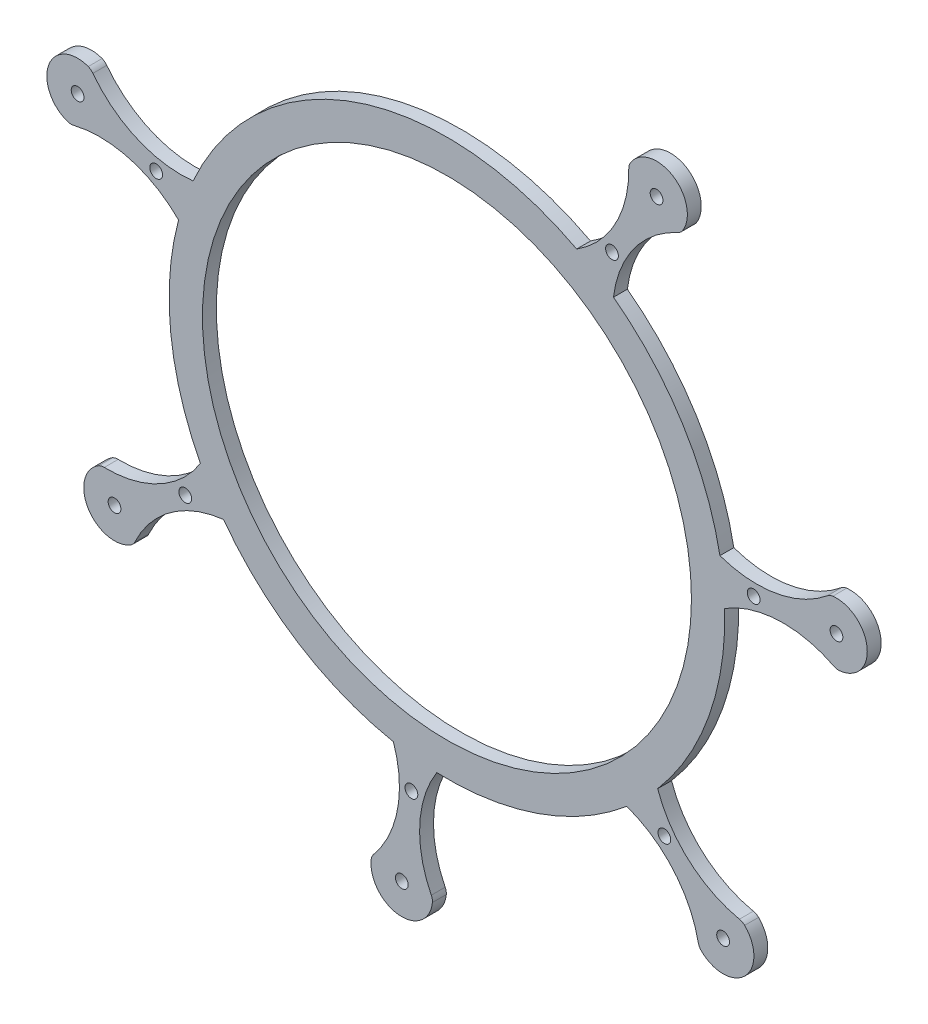
from build123d import *

# Parameters (mm, degrees)
SKETCH1_R           = 1.4605
SKETCH1_R_2         = 55.88
BOSS_EXTRUDE1_DEPTH = 3.175


with BuildPart() as part:
    # Sketch1 → Boss-Extrude1 (new body)
    with BuildSketch(Plane.XY):
        with BuildLine():
            ThreePointArc((88.371221891, 2.992104588), (75.778671602, 5.722307778), (63.466706043, 1.922066166))
            ThreePointArc((63.466706043, 1.922066166), (59.865004486, -21.176198252), (48.149108175, -41.405875631))
            ThreePointArc((48.149108175, -41.405875631), (55.331871693, -52.10275973), (66.839271225, -57.898894408))
            ThreePointArc((66.839271225, -57.898894408), (67.47896866, -58.129774903), (68.034473997, -58.522117141))
            ThreePointArc((68.034473997, -58.522117141), (68.066383731, -68.535675481), (58.053237429, -68.439394687))
            ThreePointArc((58.053237429, -68.439394687), (57.667420479, -67.877380582), (57.444971188, -67.232996469))
            ThreePointArc((57.444971188, -67.232996469), (51.728203311, -55.685490362), (41.080669811, -48.429019967))
            ThreePointArc((41.080669811, -48.429019967), (20.776095309, -60.014628604), (-2.344845215, -63.467769564))
            ThreePointArc((-2.344845215, -63.467769564), (-6.228950943, -75.752050976), (-3.586132247, -88.361783585))
            ThreePointArc((-3.586132247, -88.361783585), (-3.36770111, -89.003157809), (-3.32660045, -89.679459363))
            ThreePointArc((-3.32660045, -89.679459363), (-11.135620218, -95.947758903), (-17.303439466, -88.059135792))
            ThreePointArc((-17.303439466, -88.059135792), (-17.104674606, -87.410023107), (-16.741077367, -86.836741505))
            ThreePointArc((-16.741077367, -86.836741505), (-11.27722002, -75.167440106), (-12.242511565, -62.318527916))
            ThreePointArc((-12.242511565, -62.318527916), (-33.964407462, -53.664473517), (-51.081326085, -37.735113336))
            ThreePointArc((-51.081326085, -37.735113336), (-63.106619809, -42.363141327), (-71.313643792, -52.296473576))
            ThreePointArc((-71.313643792, -52.296473576), (-71.67843667, -52.862852869), (-72.179293677, -53.313409866))
            ThreePointArc((-72.179293677, -53.313409866), (-81.948891787, -51.116293203), (-79.626890286, -41.375621876))
            ThreePointArc((-79.626890286, -41.375621876), (-78.996252753, -41.130558358), (-78.323292008, -41.060675146))
            ThreePointArc((-78.323292008, -41.060675146), (-65.793205462, -38.056800419), (-56.34937083, -29.290939384))
            ThreePointArc((-56.34937083, -29.290939384), (-63.126842761, -6.911975648), (-61.344922052, 16.402760085))
            ThreePointArc((-61.344922052, 16.402760085), (-72.460908038, 22.91898505), (-85.344095674, 23.142163421))
            ThreePointArc((-85.344095674, 23.142163421), (-86.013413894, 23.077972745), (-86.676123345, 23.191654347))
            ThreePointArc((-86.676123345, 23.191654347), (-91.049593156, 32.199713553), (-81.986285397, 36.457508913))
            ThreePointArc((-81.986285397, 36.457508913), (-81.402337069, 36.113799392), (-80.930038908, 35.627932814))
            ThreePointArc((-80.930038908, 35.627932814), (-70.769133899, 27.704401933), (-58.027573187, 25.786339663))
            ThreePointArc((-58.027573187, 25.786339663), (-20.78382715, 59.992758023), (29.638172071, 56.145983995))
            ThreePointArc((29.638172071, 56.145983995), (38.464561255, 65.533272539), (41.548923024, 78.043789903))
            ThreePointArc((41.548923024, 78.043789903), (41.643702385, 78.713927363), (41.912089569, 79.335245044))
            ThreePointArc((41.912089569, 79.335245044), (51.667486511, 81.594581089), (53.801754345, 71.811060778))
            ThreePointArc((53.801754345, 71.811060778), (53.328466449, 71.314142081), (52.739428076, 70.96205769))
            ThreePointArc((52.739428076, 70.96205769), (42.75772259, 62.814605524), (38.058107022, 50.817562776))
            ThreePointArc((38.058107022, 50.817562776), (53.871433145, 33.600106803), (62.38288993, 11.827252681))
            ThreePointArc((62.38288993, 11.827252681), (75.225331292, 10.779382415), (86.929515737, 16.168111273))
            ThreePointArc((86.929515737, 16.168111273), (87.512909807, 16.51581617), (88.167585105, 16.696502613))
            ThreePointArc((88.167585105, 16.696502613), (96.016395661, 10.478099143), (89.698025701, 2.709536219))
            ThreePointArc((89.698025701, 2.709536219), (89.01541073, 2.76060518), (88.371221891, 2.992104588))
        make_face()
        with Locations((-10.325392041, -88.958766705)):
            Circle(SKETCH1_R, mode=Mode.SUBTRACT)
        with Locations((-8.129560177, -70.035743099)):
            Circle(SKETCH1_R, mode=Mode.SUBTRACT)
        with Locations((-75.97950865, -47.392189739)):
            Circle(SKETCH1_R, mode=Mode.SUBTRACT)
        with Locations((-59.815814277, -37.310647981)):
            Circle(SKETCH1_R, mode=Mode.SUBTRACT)
        with Locations((-84.416122315, 29.854602417)):
            Circle(SKETCH1_R, mode=Mode.SUBTRACT)
        with Locations((-66.456156975, 23.503055756)):
            Circle(SKETCH1_R, mode=Mode.SUBTRACT)
        with Locations((47.905086081, 75.649261531)):
            Circle(SKETCH1_R, mode=Mode.SUBTRACT)
        with Locations((37.716317694, 59.552942115)):
            Circle(SKETCH1_R, mode=Mode.SUBTRACT)
        with Locations((89.022339359, 9.712816136)):
            Circle(SKETCH1_R, mode=Mode.SUBTRACT)
        with Locations((70.085136904, 7.642825025)):
            Circle(SKETCH1_R, mode=Mode.SUBTRACT)
        with Locations((63.107338606, -63.544648224)):
            Circle(SKETCH1_R, mode=Mode.SUBTRACT)
        with Locations((49.68180178, -50.029565503)):
            Circle(SKETCH1_R, mode=Mode.SUBTRACT)
        with Locations((-0.003865921, -0.010935291)):
            Circle(SKETCH1_R_2, mode=Mode.SUBTRACT)
    extrude(amount=BOSS_EXTRUDE1_DEPTH)


solid = part.part
